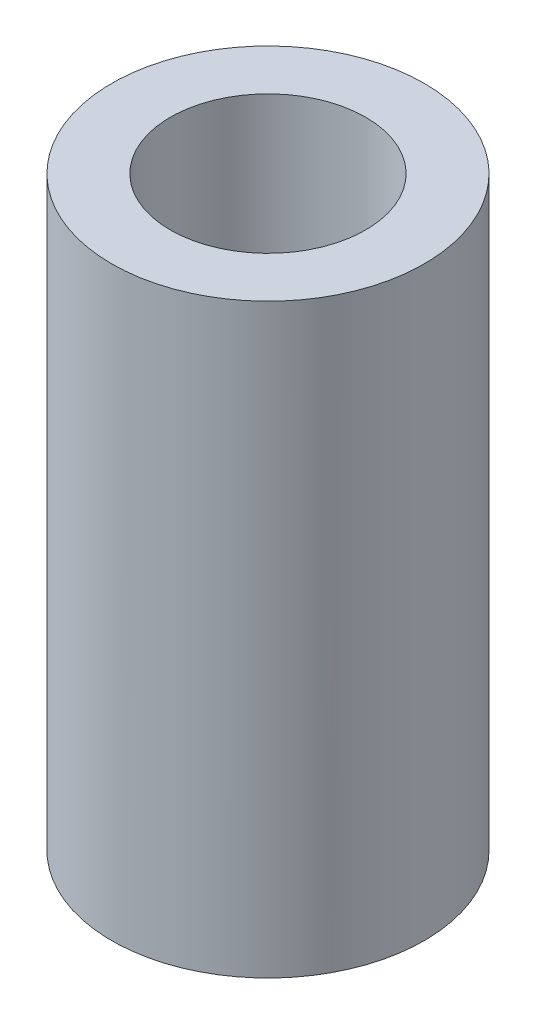
from build123d import *

# Parameters (mm, degrees)
SKETCH1_R           = 16
SKETCH1_R_2         = 10
BOSS_EXTRUDE1_DEPTH = 30
BOSS_EXTRUDE2_START = 30
SKETCH2_R           = 16
BOSS_EXTRUDE2_DEPTH = 30
SKETCH3_R           = 6.5
CUT_EXTRUDE1_DEPTH  = 30
SKETCH4_W           = 3
SKETCH4_H           = 2.5
CUT_EXTRUDE2_DEPTH  = 30


with BuildPart() as part:
    # Sketch1 → Boss-Extrude1 (new body)
    with BuildSketch(Plane(origin=(0, 0, 0), x_dir=(1, 0, 0), z_dir=(0, 1, 0))):
        with Locations(Location((0, 0, 0), (0, 0, 270))):
            Circle(SKETCH1_R)
        with Locations(Location((0, 0, 0), (0, 0, 270))):
            Circle(SKETCH1_R_2, mode=Mode.SUBTRACT)
    extrude(amount=BOSS_EXTRUDE1_DEPTH)

    # Sketch2 → Boss-Extrude2 (add)
    with BuildSketch(Plane.XZ.offset(BOSS_EXTRUDE2_START)):
        with Locations(Location((0, 0, 0), (0, 0, 270))):
            Circle(SKETCH2_R)
    extrude(amount=-BOSS_EXTRUDE2_DEPTH)

    # Sketch3 → Cut-Extrude1 (cut)
    with BuildSketch(Plane.XZ.offset(30)):
        with Locations(Location((0, 0, 0), (0, 0, 270))):
            Circle(SKETCH3_R)
    extrude(amount=-CUT_EXTRUDE1_DEPTH, mode=Mode.SUBTRACT)

    # Sketch4 → Cut-Extrude2 (cut)
    with BuildSketch(Plane.XZ.offset(30)):
        with Locations((0, -6.5)):
            Rectangle(SKETCH4_W, SKETCH4_H)
    extrude(amount=-CUT_EXTRUDE2_DEPTH, mode=Mode.SUBTRACT)


solid = part.part
